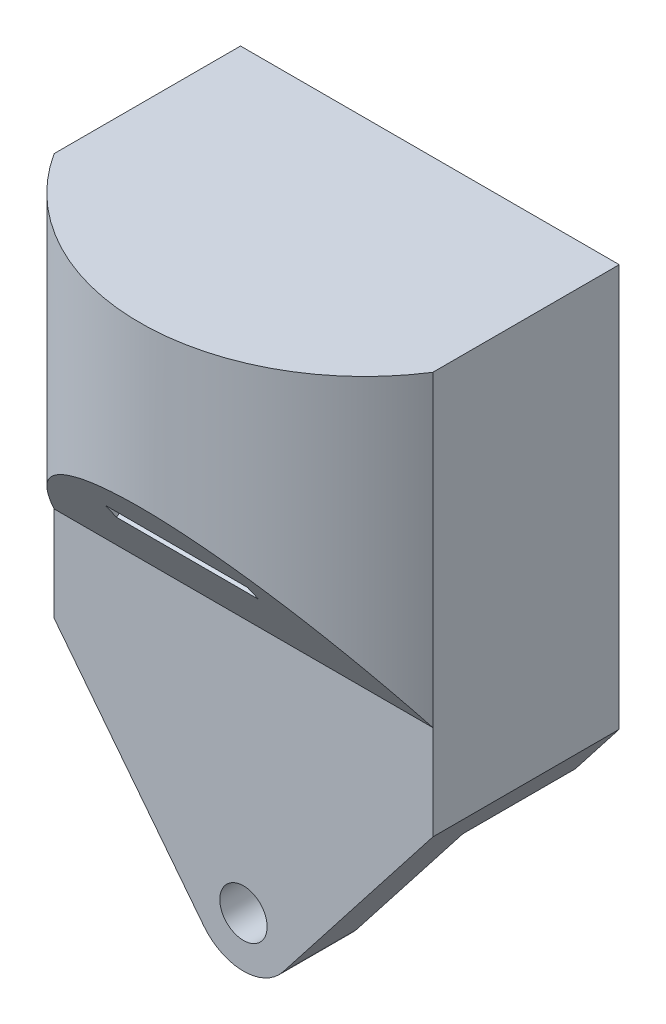
from build123d import *

# Parameters (mm, degrees)
EXTRUDE_1_DEPTH     = 25
EXTRUDE_2_DEPTH     = 104
CUT_EXTRUDE_1_DEPTH = 197.163197364
SKETCH_4_W          = 48
SKETCH_4_H          = 6.5
CUT_EXTRUDE_2_DEPTH = 3
SKETCH_5_R          = 8
CUT_EXTRUDE_3_DEPTH = 191.013157439
EXTRUDE_3_DEPTH     = 38


with BuildPart() as part:
    # Эскиз1 → Бобышка-Вытянуть1 (new body)
    with BuildSketch(Plane.XY):
        with BuildLine():
            Line((0, 0), (0, 136))
            Line((0, 136), (128, 136))
            Line((128, 136), (128, 0))
            Line((128, 0), (77.396182811, -64.769932368))
            ThreePointArc((77.396182811, -64.769932368), (64, -71.303687287), (50.603817189, -64.769932368))
            Line((50.603817189, -64.769932368), (0, 0))
        make_face()
    extrude(amount=EXTRUDE_1_DEPTH)

    # Эскиз2 → Бобышка-Вытянуть2 (add)
    with BuildSketch(Plane(origin=(0, 136, 0), x_dir=(1, 0, 0), z_dir=(0, 1, 0))):
        with BuildLine():
            Line((0, -25), (128, -25))
            ThreePointArc((128, -25), (64, -60), (0, -25))
        make_face()
    extrude(amount=-EXTRUDE_2_DEPTH)

    # Эскиз3 → Вырез-Вытянуть1 (cut, through all)
    with BuildSketch(Plane(origin=(128, 0, 0), x_dir=(0, 0, -1), z_dir=(1, 0, 0))):
        Polygon((-25, 32), (-60, 32), (-60, 82), align=None)
    extrude(amount=-CUT_EXTRUDE_1_DEPTH, mode=Mode.SUBTRACT)

    # Эскиз4 → Вырез-Вытянуть2 (cut)
    with BuildSketch(Plane(origin=(0, -1.22147651, 1.744966443), x_dir=(1, 0, 0), z_dir=(0, -0.5734623443633285, 0.8192319205190403))):
        with Locations((64, 76.801980066)):
            Rectangle(SKETCH_4_W, SKETCH_4_H)
    extrude(amount=-CUT_EXTRUDE_2_DEPTH, mode=Mode.SUBTRACT)

    # Эскиз5 → Вырез-Вытянуть3 (cut, through all)
    with BuildSketch(Plane.XY.offset(25)):
        with Locations((64, -54.303687287)):
            Circle(SKETCH_5_R)
    extrude(amount=-CUT_EXTRUDE_3_DEPTH, mode=Mode.SUBTRACT)

    # Эскиз6 → Бобышка-Вытянуть3 (add)
    with BuildSketch(Plane(origin=(0, 0, 0), x_dir=(-1, 0, 0), z_dir=(0, 0, -1))):
        Polygon((-128, 136), (0, 136), (0, 0), (-14.844426904, -19), (-113.155573096, -19), (-128, 0), align=None)
    extrude(amount=EXTRUDE_3_DEPTH)


solid = part.part
